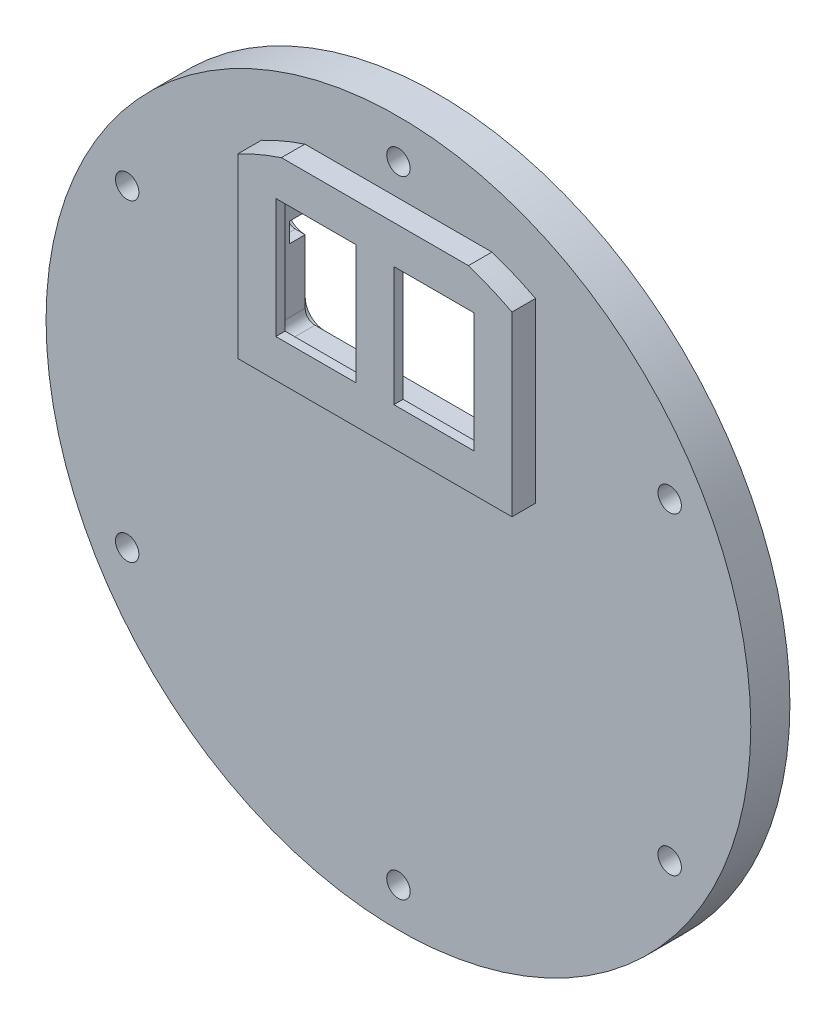
from build123d import *

# Parameters (mm, degrees)
SKETCH1_R                                       = 57.15
BOSS_EXTRUDE1_DEPTH                             = 6.35
SKETCH2_W                                       = 44.45
SKETCH2_H                                       = 31.75
BOSS_EXTRUDE2_DEPTH                             = 3.81
SKETCH3_W                                       = 13
SKETCH3_H                                       = 19.4
CUT_EXTRUDE1_DEPTH                              = 82.458397971
SKETCH4_W                                       = 39.77
SKETCH4_H                                       = 27.02
CUT_EXTRUDE2_DEPTH                              = 8.66
FILLET1_R                                       = 1.5875
CUT_EXTRUDE3_DEPTH                              = 1.5875
CBORE_FOR_6_PAN_HEAD_MACHINE_SCREW1_D           = 3.7973
CBORE_FOR_6_PAN_HEAD_MACHINE_SCREW1_CBORE_D     = 7.54126
CBORE_FOR_6_PAN_HEAD_MACHINE_SCREW1_CBORE_DEPTH = 2.4638
CIRPATTERN1_COUNT                               = 6
SKETCH27_R                                      = 63.5
SKETCH27_R_2                                    = 48.133
CUT_EXTRUDE14_DEPTH                             = 82.071372876
CUT_EXTRUDE15_DEPTH                             = 2.54


with BuildPart() as part:
    # Sketch1 → Boss-Extrude1 (new body)
    with BuildSketch(Plane.XY):
        Circle(SKETCH1_R)
    extrude(amount=BOSS_EXTRUDE1_DEPTH)

    # Sketch2 → Boss-Extrude2 (add)
    with BuildSketch(Plane.XY.offset(6.35)):
        with Locations((0, 29.80529526)):
            Rectangle(SKETCH2_W, SKETCH2_H)
    extrude(amount=BOSS_EXTRUDE2_DEPTH)

    # Sketch3 → Cut-Extrude1 (cut, through all)
    with BuildSketch(Plane.XY.offset(10.16)):
        with Locations((-9.575, 29.80529526)):
            Rectangle(SKETCH3_W, SKETCH3_H)
        with Locations((9.575, 29.80529526)):
            Rectangle(SKETCH3_W, SKETCH3_H)
    extrude(amount=-CUT_EXTRUDE1_DEPTH, mode=Mode.SUBTRACT)

    # Sketch4 → Cut-Extrude2 (cut)
    with BuildSketch(Plane(origin=(0, 0, 0), x_dir=(-1, 0, 0), z_dir=(0, 0, -1))):
        with Locations((0, 29.80529526)):
            Rectangle(SKETCH4_W, SKETCH4_H)
    extrude(amount=-CUT_EXTRUDE2_DEPTH, mode=Mode.SUBTRACT)

    # Fillet1
    fillet1_edges = [part.edges().sort_by_distance(p)[0] for p in [
        (-19.885, 16.29529526, 4.33),
        (-19.885, 43.31529526, 4.33),
        (19.885, 43.31529526, 4.33),
        (19.885, 16.29529526, 4.33),
    ]]
    fillet(fillet1_edges, radius=FILLET1_R)

    # Sketch8 → Cut-Extrude3 (cut)
    with BuildSketch(Plane(origin=(0, 0, 0), x_dir=(-1, 0, 0), z_dir=(0, 0, -1))):
        with BuildLine():
            Line((18.2975, 44.90279526), (-18.2975, 44.90279526))
            ThreePointArc((-18.2975, 44.90279526), (-20.54256403, 43.97285929), (-21.4725, 41.72779526))
            Line((-21.4725, 41.72779526), (-21.4725, 32.98029526))
            ThreePointArc((-21.4725, 32.98029526), (-24.6475, 29.80529526), (-21.4725, 26.63029526))
            Line((-21.4725, 26.63029526), (-21.4725, 17.88279526))
            ThreePointArc((-21.4725, 17.88279526), (-20.54256403, 15.637731229), (-18.2975, 14.70779526))
            Line((-18.2975, 14.70779526), (18.2975, 14.70779526))
            ThreePointArc((18.2975, 14.70779526), (20.54256403, 15.637731229), (21.4725, 17.88279526))
            Line((21.4725, 17.88279526), (21.4725, 26.63029526))
            ThreePointArc((21.4725, 26.63029526), (24.6475, 29.80529526), (21.4725, 32.98029526))
            Line((21.4725, 32.98029526), (21.4725, 41.72779526))
            ThreePointArc((21.4725, 41.72779526), (20.54256403, 43.97285929), (18.2975, 44.90279526))
        make_face()
    extrude(amount=-CUT_EXTRUDE3_DEPTH, mode=Mode.SUBTRACT)

    # CBORE for #6 Pan Head Machine Screw1 (through all)
    with Locations(Plane(origin=(0, 0, 0), x_dir=(-1, 0, 0), z_dir=(0, 0, -1))):
        with Locations((-43.994090512, -25.4)):
            cbore_for_6_pan_head_machine_screw1 = CounterBoreHole(CBORE_FOR_6_PAN_HEAD_MACHINE_SCREW1_D / 2, CBORE_FOR_6_PAN_HEAD_MACHINE_SCREW1_CBORE_D / 2, CBORE_FOR_6_PAN_HEAD_MACHINE_SCREW1_CBORE_DEPTH)

    # CirPattern1: CBORE for #6 Pan Head Machine Screw1 ×6 about axis
    cirpattern1_axis = Axis((0, 0, 0), (0, 0, 1))
    for i in range(1, CIRPATTERN1_COUNT):
        add(cbore_for_6_pan_head_machine_screw1.rotate(cirpattern1_axis, i * 360 / CIRPATTERN1_COUNT), mode=Mode.SUBTRACT)

    # Sketch27 → Cut-Extrude14 (cut, through all)
    with BuildSketch(Plane.XY.offset(6.35)):
        Circle(SKETCH27_R)
        Circle(SKETCH27_R_2, mode=Mode.SUBTRACT)
    extrude(amount=CUT_EXTRUDE14_DEPTH, mode=Mode.SUBTRACT)

    # Sketch28 → Cut-Extrude15 (cut)
    with BuildSketch(Plane(origin=(0, 0, 1.5875), x_dir=(-1, 0, 0), z_dir=(0, 0, -1))):
        with BuildLine():
            Line((-21.4725, 31.39279526), (-19.885, 31.39279526))
            Line((-19.885, 31.39279526), (-19.885, 28.21779526))
            Line((-19.885, 28.21779526), (-21.4725, 28.21779526))
            ThreePointArc((-21.4725, 28.21779526), (-23.06, 29.80529526), (-21.4725, 31.39279526))
        make_face()
        with BuildLine():
            Line((21.4725, 28.21779526), (19.885, 28.21779526))
            Line((19.885, 28.21779526), (19.885, 31.39279526))
            Line((19.885, 31.39279526), (21.4725, 31.39279526))
            ThreePointArc((21.4725, 31.39279526), (23.06, 29.80529526), (21.4725, 28.21779526))
        make_face()
    extrude(amount=-CUT_EXTRUDE15_DEPTH, mode=Mode.SUBTRACT)


solid = part.part
